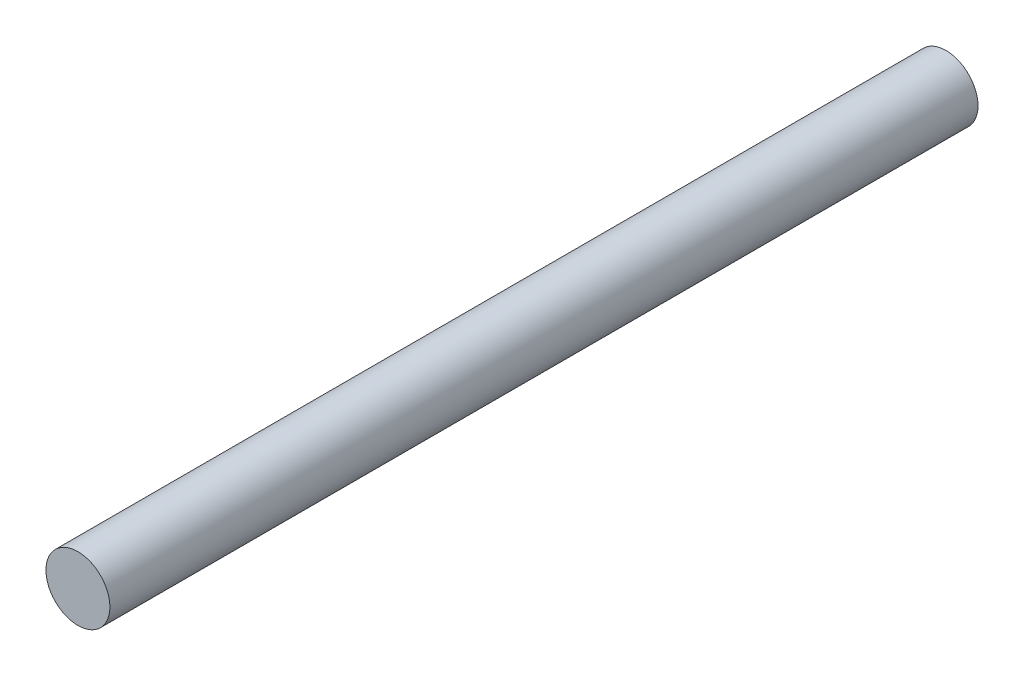
from build123d import *

# Parameters (mm, degrees)
ESQUISSE1_R        = 3.5
BOSS_EXTRU_1_DEPTH = 95


with BuildPart() as part:
    # Esquisse1 → Boss.-Extru.1 (new body)
    with BuildSketch(Plane.XY):
        Circle(ESQUISSE1_R)
    extrude(amount=BOSS_EXTRU_1_DEPTH)


solid = part.part
